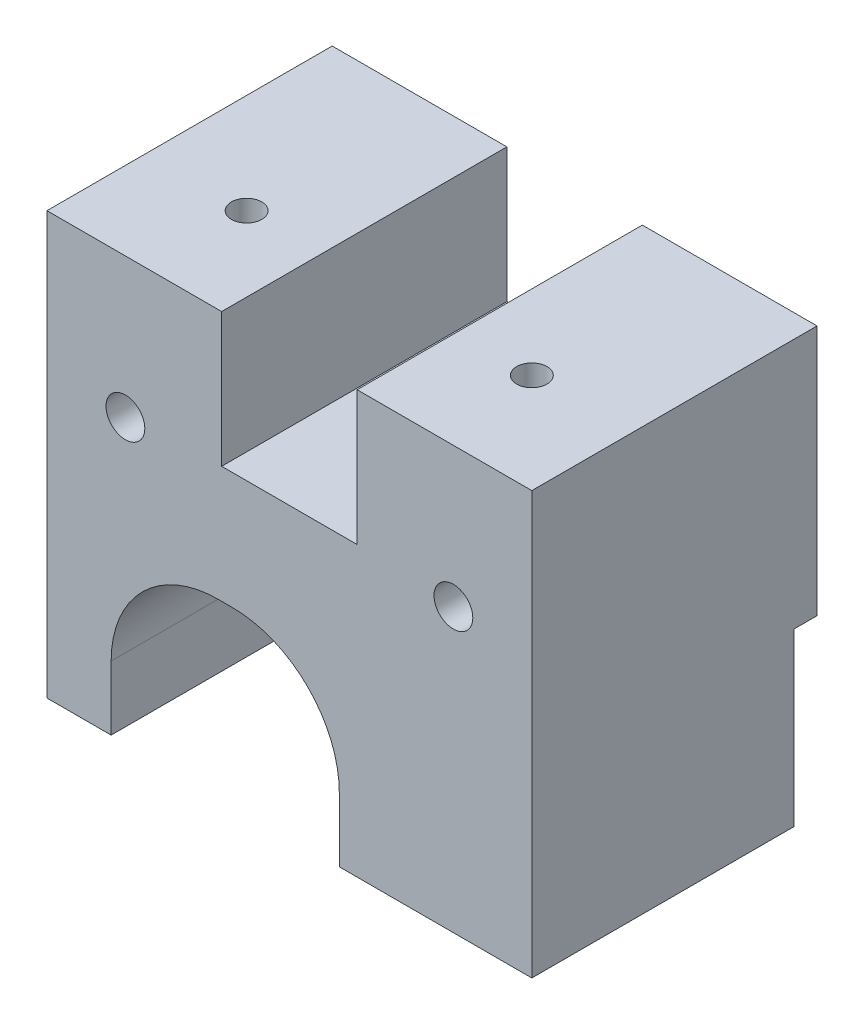
from build123d import *

# Parameters (mm, degrees)
SKETCH1_W                 = 43.18
SKETCH1_H                 = 25.4
BASE_DEPTH                = 37.592
SKETCH2_W                 = 12.065
SKETCH2_H                 = 11.938
LINACTSLOT_DEPTH          = 51.24387091
MOUTINGHOLES_D            = 2.7051
MOUTINGHOLES_DEPTH        = 14.478
MOUTINGHOLES_TIP          = 0.81269403
MOTORSLOT_DEPTH           = 51.24387091
MOTORMOUNTINGHOLES2_D     = 2.2606
MOTORMOUNTINGHOLES2_DEPTH = 11.43
MOTORMOUNTINGHOLES2_TIP   = 0.679152758
F_8_32_TAPPED_HOLE1_D     = 3.4544
F_8_32_TAPPED_HOLE1_DEPTH = 7.62
F_8_32_TAPPED_HOLE1_TIP   = 1.037806461
SKETCH23_W                = 43.18
SKETCH23_H                = 15.24
CUT_EXTRUDE1_DEPTH        = 2.032


with BuildPart() as part:
    # Sketch1 → Base (new body)
    with BuildSketch(Plane(origin=(0, 0, 0), x_dir=(1, 0, 0), z_dir=(0, 1, 0))):
        Rectangle(SKETCH1_W, SKETCH1_H)
    extrude(amount=BASE_DEPTH)

    # Sketch2 → LinActSlot (cut, through all)
    with BuildSketch(Plane.XY.offset(12.7)):
        with Locations((0, 31.623)):
            Rectangle(SKETCH2_W, SKETCH2_H)
    extrude(amount=-LINACTSLOT_DEPTH, mode=Mode.SUBTRACT)

    # MoutingHoles
    with Locations(Plane(origin=(14.160350453, 37.592, 8.373414988), x_dir=(-1, 0, 0), z_dir=(0, 1, 0))):
        with Locations((1.460350453, -4.563414988), (26.860350453, -4.563414988)):
            Hole(MOUTINGHOLES_D / 2, depth=MOUTINGHOLES_DEPTH)
            with Locations((0, 0, -(MOUTINGHOLES_DEPTH + MOUTINGHOLES_TIP / 2))):  # 118° drill point
                Cone(0, MOUTINGHOLES_D / 2, MOUTINGHOLES_TIP, mode=Mode.SUBTRACT)

    # Sketch11 → MotorSlot (cut, through all)
    with BuildSketch(Plane(origin=(0, 0, -12.7), x_dir=(-1, 0, 0), z_dir=(0, 0, -1))):
        with BuildLine():
            Line((15.875, 5.08), (15.875, 5.715))
            ThreePointArc((15.875, 5.715), (13.085192091, 12.450192091), (6.35, 15.24))
            Line((6.35, 15.24), (5.08, 15.24))
            ThreePointArc((5.08, 15.24), (-1.655192091, 12.450192091), (-4.445, 5.715))
            Line((-4.445, 5.715), (-4.445, 5.08))
            Line((-4.445, 5.08), (-4.445, 0))
            Line((-4.445, 0), (15.875, 0))
            Line((15.875, 0), (15.875, 5.08))
        make_face()
    extrude(amount=-MOTORSLOT_DEPTH, mode=Mode.SUBTRACT)

    # MotorMountingHoles2
    with Locations(Plane(origin=(0, 0, -12.7), x_dir=(-1, 0, 0), z_dir=(0, 0, -1))):
        with Locations((18.215, 5.715), (-6.785, 5.715)):
            Hole(MOTORMOUNTINGHOLES2_D / 2, depth=MOTORMOUNTINGHOLES2_DEPTH)
            with Locations((0, 0, -(MOTORMOUNTINGHOLES2_DEPTH + MOTORMOUNTINGHOLES2_TIP / 2))):  # 118° drill point
                Cone(0, MOTORMOUNTINGHOLES2_D / 2, MOTORMOUNTINGHOLES2_TIP, mode=Mode.SUBTRACT)

    # #8-32 Tapped Hole1
    with Locations(Plane.XY.offset(12.7)):
        with Locations((-14.605, 25.146), (14.605, 25.146)):
            Hole(F_8_32_TAPPED_HOLE1_D / 2, depth=F_8_32_TAPPED_HOLE1_DEPTH)
            with Locations((0, 0, -(F_8_32_TAPPED_HOLE1_DEPTH + F_8_32_TAPPED_HOLE1_TIP / 2))):  # 118° drill point
                Cone(0, F_8_32_TAPPED_HOLE1_D / 2, F_8_32_TAPPED_HOLE1_TIP, mode=Mode.SUBTRACT)

    # Sketch23 → Cut-Extrude1 (cut)
    with BuildSketch(Plane(origin=(0, 0, -12.7), x_dir=(-1, 0, 0), z_dir=(0, 0, -1))):
        with Locations((0, 7.62)):
            Rectangle(SKETCH23_W, SKETCH23_H)
    extrude(amount=-CUT_EXTRUDE1_DEPTH, mode=Mode.SUBTRACT)


solid = part.part
